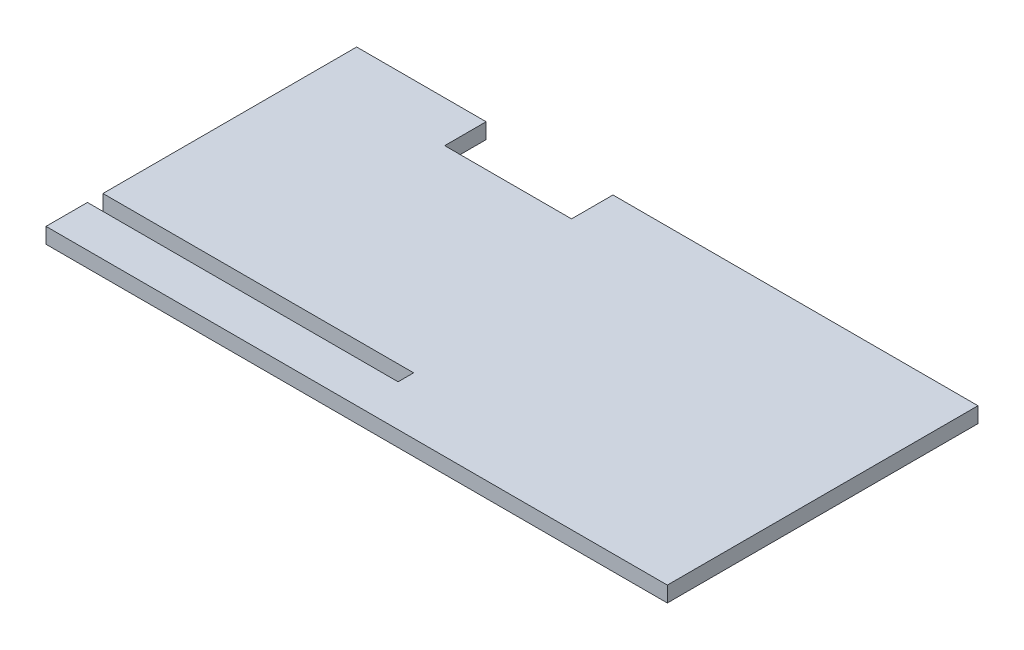
from build123d import *

# Parameters (mm, degrees)
BOSS_EXTRUDE1_DEPTH = 3


with BuildPart() as part:
    # Sketch1 → Boss-Extrude1 (new body)
    with BuildSketch(Plane(origin=(0, 0, 0), x_dir=(1, 0, 0), z_dir=(0, 1, 0))):
        Polygon((-60, 40), (-60, -9), (0, -9), (0, -12), (-60, -12), (-60, -20), (60, -20), (60, 40), (-10.5, 40), (-10.5, 32), (-35, 32), (-35, 40), align=None)
    extrude(amount=BOSS_EXTRUDE1_DEPTH)


solid = part.part
